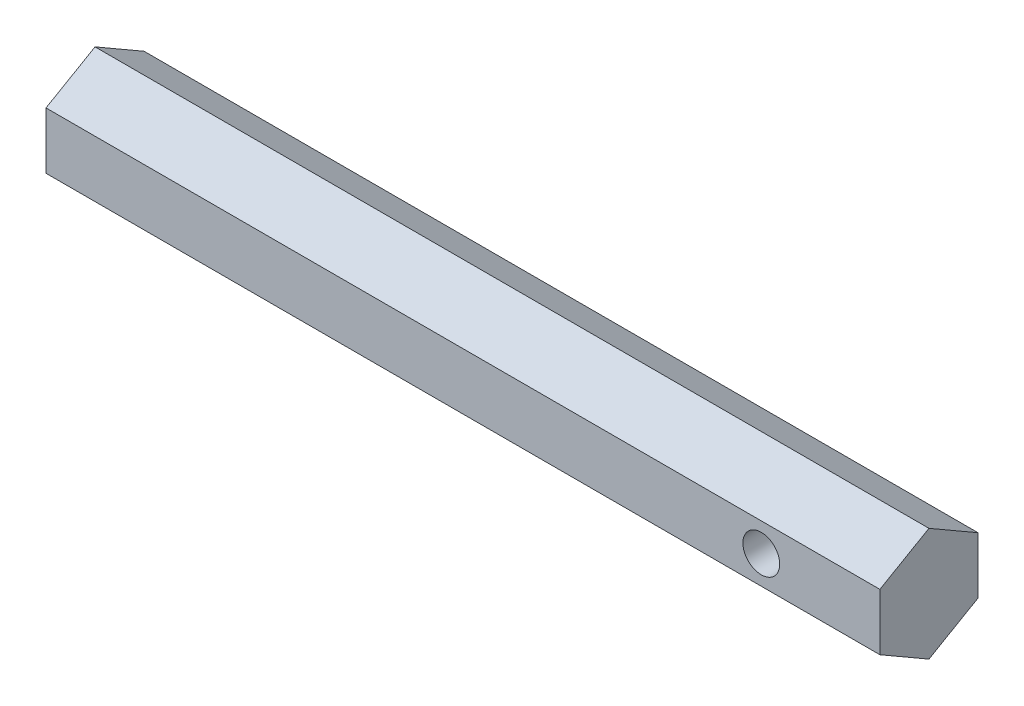
from build123d import *

# Parameters (mm, degrees)
BOSS_EXTRUDE1_DEPTH = 107.95
SKETCH2_R           = 2.38125
CUT_EXTRUDE1_DEPTH  = 109.941524835


with BuildPart() as part:
    # Sketch1 → Boss-Extrude1 (new body)
    with BuildSketch(Plane(origin=(0, 0, 0), x_dir=(0, 0, -1), z_dir=(1, 0, 0))):
        Polygon((6.35, -3.666174209), (6.35, 3.666174209), (0, 7.332348419), (-6.35, 3.666174209), (-6.35, -3.666174209), (0, -7.332348419), align=None)
    extrude(amount=BOSS_EXTRUDE1_DEPTH)

    # Sketch2 → Cut-Extrude1 (cut, through all)
    with BuildSketch(Plane.XY.offset(6.35)):
        with Locations((92.5968176, 0)):
            Circle(SKETCH2_R)
    extrude(amount=-CUT_EXTRUDE1_DEPTH, mode=Mode.SUBTRACT)


solid = part.part
